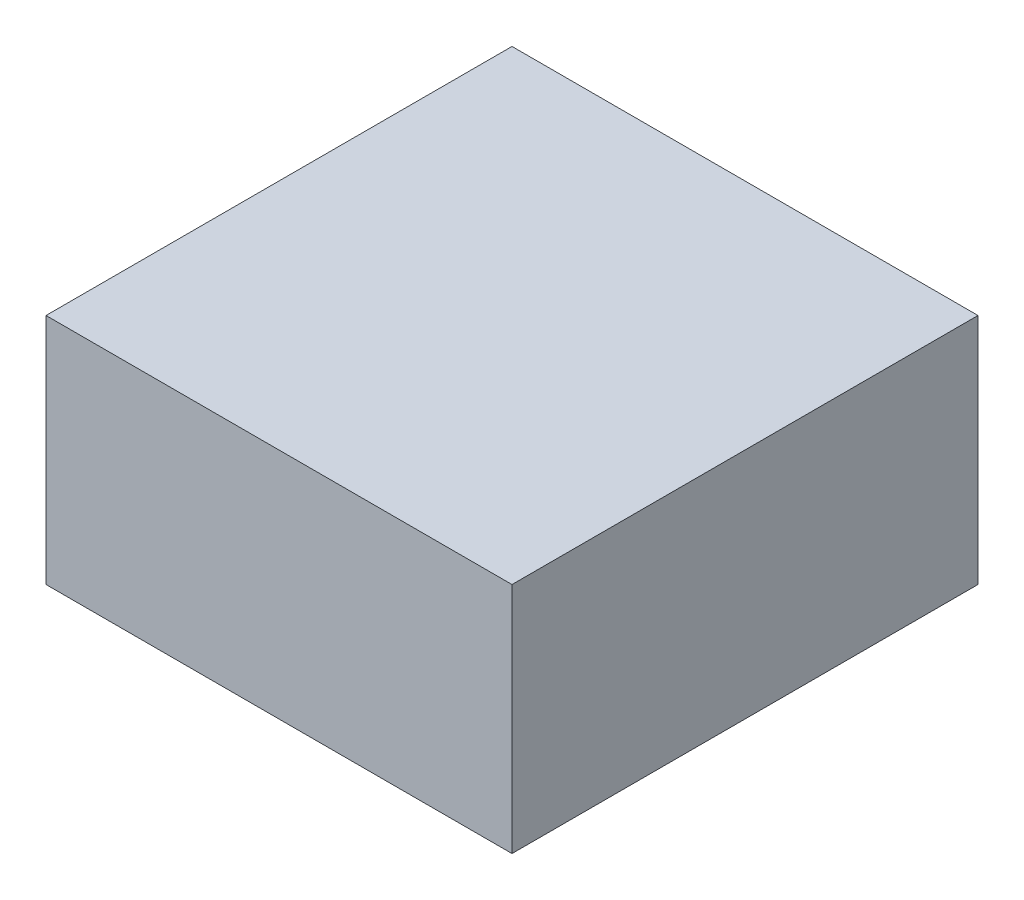
from build123d import *

# Parameters (mm, degrees)
SKETCH1_W           = 20.246913578
SKETCH1_H           = 20.246913578
BOSS_EXTRUDE1_DEPTH = 10.123456789


with BuildPart() as part:
    # Sketch1 → Boss-Extrude1 (new body)
    with BuildSketch(Plane(origin=(0, 0, 0), x_dir=(1, 0, 0), z_dir=(0, 1, 0))):
        Rectangle(SKETCH1_W, SKETCH1_H)
    extrude(amount=BOSS_EXTRUDE1_DEPTH)


solid = part.part
